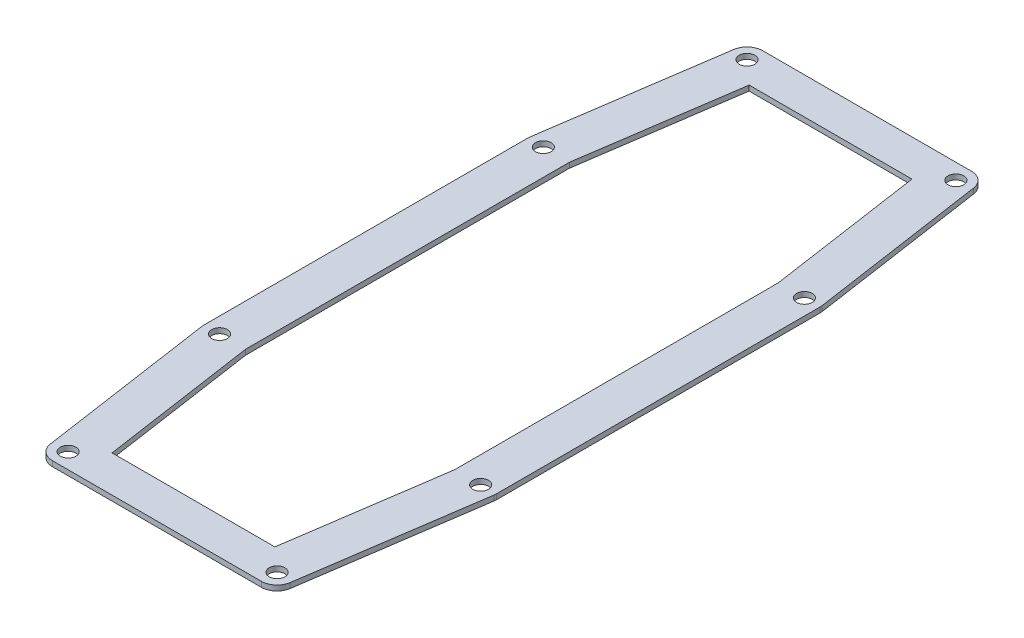
from build123d import *

# Parameters (mm, degrees)
SKETCH_1_R      = 1.5
EXTRUDE_1_DEPTH = 1


with BuildPart() as part:
    # 草图1 → 凸台-拉伸1 (new body)
    with BuildSketch(Plane(origin=(0, 0, 0), x_dir=(1, 0, 0), z_dir=(0, 1, 0))):
        with BuildLine():
            Line((5, 99), (45, 99))
            ThreePointArc((45, 99), (46.960937797, 98.270401497), (47.968077406, 96.436481971))
            Line((47.968077406, 96.436481971), (52.968077406, 62.436481971))
            ThreePointArc((52.968077406, 62.436481971), (52.992008708, 62.218823881), (53, 62))
            Line((53, 62), (53, 0))
            ThreePointArc((53, 0), (52.992008708, -0.218823881), (52.968077406, -0.436481971))
            Line((52.968077406, -0.436481971), (47.968077406, -34.436481971))
            ThreePointArc((47.968077406, -34.436481971), (46.960937797, -36.270401497), (45, -37))
            Line((45, -37), (5, -37))
            ThreePointArc((5, -37), (3.039062203, -36.270401497), (2.031922594, -34.436481971))
            Line((2.031922594, -34.436481971), (-2.968077406, -0.436481971))
            ThreePointArc((-2.968077406, -0.436481971), (-2.992008708, -0.218823881), (-3, 0))
            Line((-3, 0), (-3, 62))
            ThreePointArc((-3, 62), (-2.992008708, 62.218823881), (-2.968077406, 62.436481971))
            Line((-2.968077406, 62.436481971), (2.031922594, 96.436481971))
            ThreePointArc((2.031922594, 96.436481971), (3.039062203, 98.270401497), (5, 99))
        make_face()
        with Locations(Location((0, 62, 0), (0, 0, 270))):
            Circle(SKETCH_1_R, mode=Mode.SUBTRACT)
        with Locations(Location((50, 62, 0), (0, 0, 270))):
            Circle(SKETCH_1_R, mode=Mode.SUBTRACT)
        with Locations(Location((0, 0, 0), (0, 0, 270))):
            Circle(SKETCH_1_R, mode=Mode.SUBTRACT)
        with Locations(Location((50, 0, 0), (0, 0, 270))):
            Circle(SKETCH_1_R, mode=Mode.SUBTRACT)
        with Locations(Location((5, 96, 0), (0, 0, 270))):
            Circle(SKETCH_1_R, mode=Mode.SUBTRACT)
        with Locations(Location((45, 96, 0), (0, 0, 270))):
            Circle(SKETCH_1_R, mode=Mode.SUBTRACT)
        with Locations(Location((5, -34, 0), (0, 0, 270))):
            Circle(SKETCH_1_R, mode=Mode.SUBTRACT)
        with Locations(Location((45, -34, 0), (0, 0, 270))):
            Circle(SKETCH_1_R, mode=Mode.SUBTRACT)
        Polygon((9.411764706, 92), (5, 62), (5, 0), (9.411764706, -30), (40.588235294, -30), (45, 0), (45, 62), (40.588235294, 92), align=None, mode=Mode.SUBTRACT)
    extrude(amount=EXTRUDE_1_DEPTH)


solid = part.part
